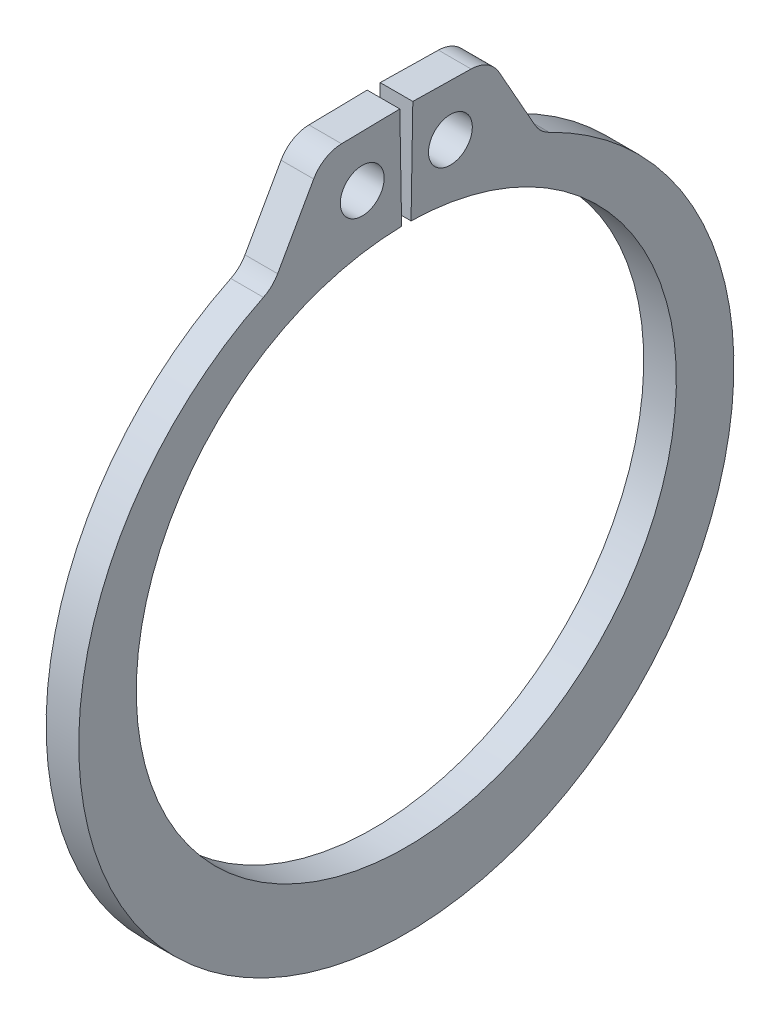
from build123d import *

# Parameters (mm, degrees)
SKETCH1_R      = 0.5969
EXTRUDE1_DEPTH = 0.4445
FILLET1_R      = 0.889


with BuildPart() as part:
    # Sketch1 → Extrude1 (new, symmetric)
    with BuildSketch(Plane(origin=(0, 0, 0), x_dir=(0, 0, -1), z_dir=(1, 0, 0))):
        with BuildLine():
            Line((-0.12833278, 7.352180057), (-0.177094804, 10.145754517))
            Line((-0.177094804, 10.145754517), (-2.272275649, 10.109182999))
            Line((-2.272275649, 10.109182999), (-3.644085943, 7.675138522))
            ThreePointArc((-3.644085943, 7.675138522), (0, -9.3853), (3.644085943, 7.675138522))
            Line((3.644085943, 7.675138522), (2.272275649, 10.109182999))
            Line((2.272275649, 10.109182999), (0.177094804, 10.145754517))
            Line((0.177094804, 10.145754517), (0.12833278, 7.352180057))
            ThreePointArc((0.12833278, 7.352180057), (0, -7.3533), (-0.12833278, 7.352180057))
        make_face()
        with Locations((-1.200304215, 8.730681528)):
            Circle(SKETCH1_R, mode=Mode.SUBTRACT)
        with Locations((1.200304215, 8.730681528)):
            Circle(SKETCH1_R, mode=Mode.SUBTRACT)
    extrude(amount=EXTRUDE1_DEPTH, both=True)

    # Fillet1
    fillet1_edges = [part.edges().sort_by_distance(p)[0] for p in [
        (0, 10.109182999, -2.272275649),
        (0, 7.675138522, -3.644085943),
        (0, 7.675138522, 3.644085943),
        (0, 10.109182999, 2.272275649),
    ]]
    fillet(fillet1_edges, radius=FILLET1_R)


solid = part.part
